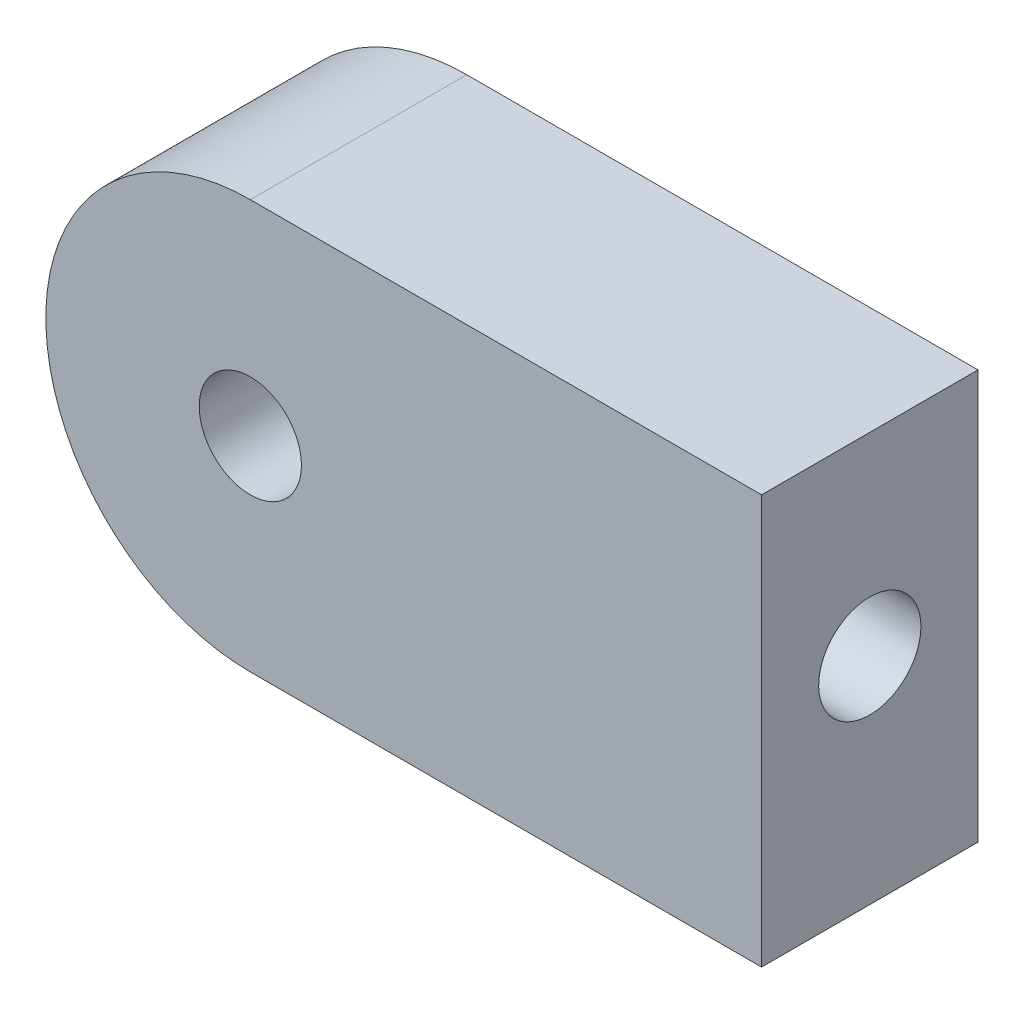
from build123d import *

# Parameters (mm, degrees)
BOSS_EXTRU_1_DEPTH      = 6.35
ESQUISSE3_R             = 1.5
ENL_V_MAT_EXTRU_1_DEPTH = 6.35
ESQUISSE4_R             = 1.5
ENL_V_MAT_EXTRU_2_DEPTH = 6.35


with BuildPart() as part:
    # Esquisse2 → Boss.-Extru.1 (new body)
    with BuildSketch(Plane.XY):
        with BuildLine():
            Line((0, 6), (15, 6))
            Line((15, 6), (15, -6))
            Line((15, -6), (0, -6))
            ThreePointArc((0, -6), (-6, 0), (0, 6))
        make_face()
    extrude(amount=BOSS_EXTRU_1_DEPTH)

    # Esquisse3 → Enlèv. mat.-Extru.1 (cut)
    with BuildSketch(Plane(origin=(15, 0, 0), x_dir=(0, 0, -1), z_dir=(1, 0, 0))):
        with Locations(Location((-3.175, 0.318926735, 0), (0, 0, 90))):
            Circle(ESQUISSE3_R)
    extrude(amount=-ENL_V_MAT_EXTRU_1_DEPTH, mode=Mode.SUBTRACT)

    # Esquisse4 → Enlèv. mat.-Extru.2 (cut)
    with BuildSketch(Plane.XY.offset(6.35)):
        Circle(ESQUISSE4_R)
    extrude(amount=-ENL_V_MAT_EXTRU_2_DEPTH, mode=Mode.SUBTRACT)


solid = part.part
